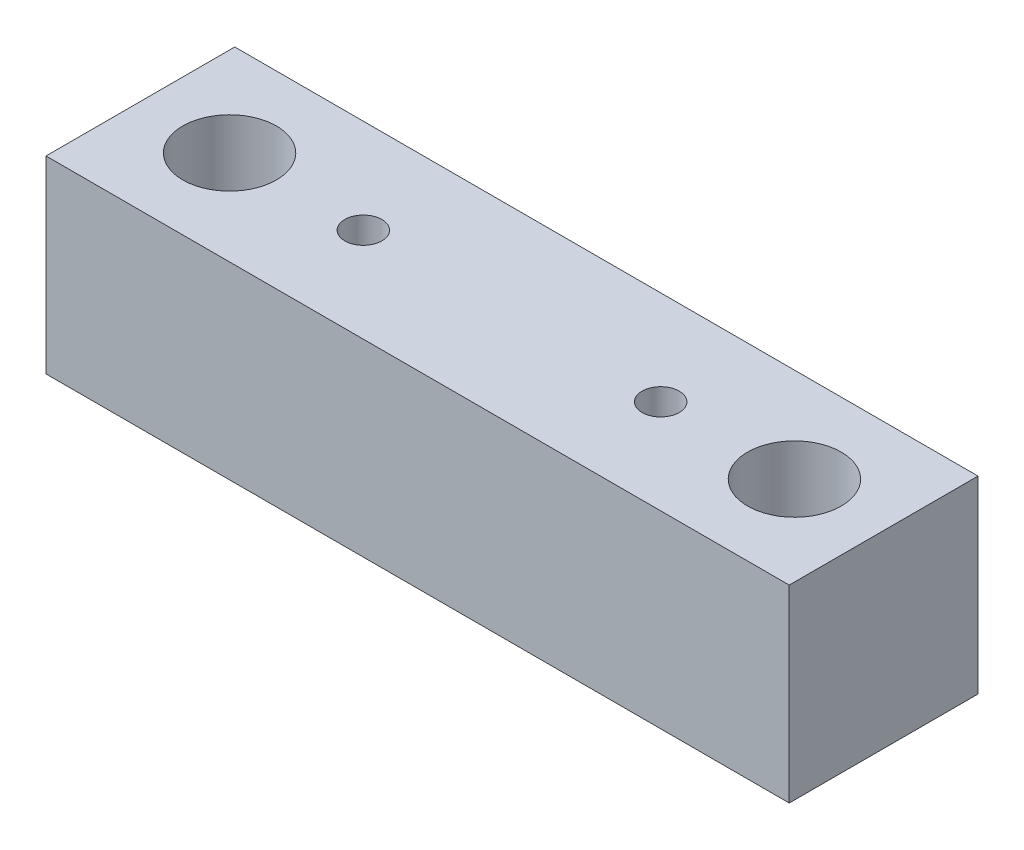
from build123d import *

# Parameters (mm, degrees)
SKETCH2_W           = 50
SKETCH2_H           = 12.7
SKETCH2_R           = 3.15
SKETCH2_R_2         = 1.25
BOSS_EXTRUDE1_DEPTH = 12.7


with BuildPart() as part:
    # Sketch2 → Boss-Extrude1 (new body)
    with BuildSketch(Plane(origin=(0, 0, 0), x_dir=(1, 0, 0), z_dir=(0, 1, 0))):
        with Locations((25, 6.35)):
            Rectangle(SKETCH2_W, SKETCH2_H)
        with Locations(Location((6, 6.35, 0), (0, 0, 270))):
            Circle(SKETCH2_R, mode=Mode.SUBTRACT)
        with Locations(Location((15, 6.35, 0), (0, 0, 270))):
            Circle(SKETCH2_R_2, mode=Mode.SUBTRACT)
        with Locations(Location((35, 6.35, 0), (0, 0, 90))):
            Circle(SKETCH2_R_2, mode=Mode.SUBTRACT)
        with Locations(Location((44, 6.35, 0), (0, 0, 90))):
            Circle(SKETCH2_R, mode=Mode.SUBTRACT)
    extrude(amount=BOSS_EXTRUDE1_DEPTH)


solid = part.part
